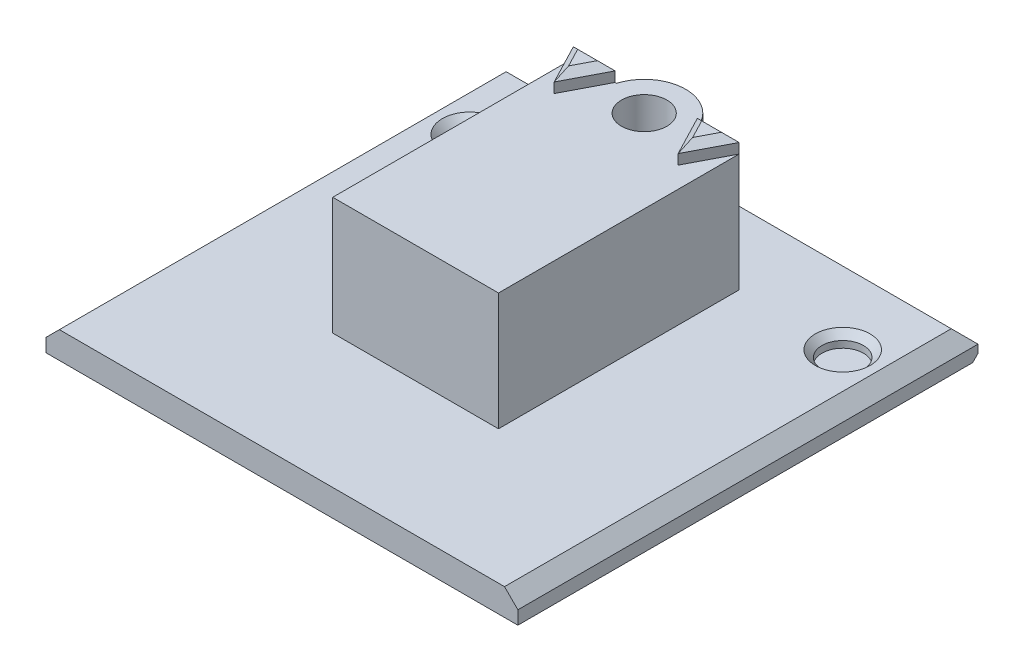
from build123d import *

# Parameters (mm, degrees)
SKETCH1_W           = 35.3
SKETCH1_H           = 34.42
BOSS_EXTRUDE1_DEPTH = 2
BOSS_EXTRUDE2_DEPTH = 8.8
SKETCH4_R           = 1.55
CUT_EXTRUDE2_DEPTH  = 1
CHAMFER4_SIZE       = 0.5
BOSS_EXTRUDE3_DEPTH = 1.25
SKETCH7_R           = 1.7
CUT_EXTRUDE6_DEPTH  = 51.472432079
SKETCH6_R           = 2.85
CUT_EXTRUDE5_DEPTH  = 3
CHAMFER5_SIZE       = 0.5
CHAMFER3_SIZE       = 1
CHAMFER6_SIZE       = 0.4


with BuildPart() as part:
    # Sketch1 → Boss-Extrude1 (new body)
    with BuildSketch(Plane(origin=(0, 0, 0), x_dir=(1, 0, 0), z_dir=(0, 1, 0))):
        with Locations((17.65, 17.21)):
            Rectangle(SKETCH1_W, SKETCH1_H)
    extrude(amount=BOSS_EXTRUDE1_DEPTH)

    # Sketch2 → Boss-Extrude2 (add)
    with BuildSketch(Plane(origin=(0, 2, 0), x_dir=(1, 0, 0), z_dir=(0, 1, 0))):
        with BuildLine():
            Line((11.45, 28), (14.683520605, 28))
            ThreePointArc((14.683520605, 28), (17.65, 30.2), (20.616479395, 28))
            Line((20.616479395, 28), (23.85, 28))
            Line((23.85, 28), (23.85, 10))
            Line((23.85, 10), (11.45, 10))
            Line((11.45, 10), (11.45, 28))
        make_face()
    extrude(amount=BOSS_EXTRUDE2_DEPTH)

    # Sketch4 → Cut-Extrude2 (cut)
    with BuildSketch(Plane(origin=(0, 2, 0), x_dir=(1, 0, 0), z_dir=(0, 1, 0))):
        with Locations(Location((3.7, 28, 0), (0, 0, 270))):
            Circle(SKETCH4_R)
        with Locations(Location((31.6, 28, 0), (0, 0, 90))):
            Circle(SKETCH4_R)
    extrude(amount=-CUT_EXTRUDE2_DEPTH, mode=Mode.SUBTRACT)

    # Chamfer4
    chamfer4_edges = [part.edges().sort_by_distance(p)[0] for p in [
        (3.7, 2, -29.55),
        (31.6, 2, -26.45),
    ]]
    chamfer(chamfer4_edges, length=CHAMFER4_SIZE)

    # Sketch3 → Boss-Extrude3 (add)
    with BuildSketch(Plane(origin=(0, 10.8, 0), x_dir=(1, 0, 0), z_dir=(0, 1, 0))):
        Polygon((14.573402303, 28), (13.011701152, 25), (11.45, 28), align=None)
        Polygon((23.85, 28), (22.288298848, 25), (20.726597697, 28), align=None)
    extrude(amount=BOSS_EXTRUDE3_DEPTH)

    # Sketch7 → Cut-Extrude6 (cut, through all)
    with BuildSketch(Plane(origin=(0, 10.8, 0), x_dir=(1, 0, 0), z_dir=(0, 1, 0))):
        with Locations(Location((17.65, 27.1, 0), (0, 0, 270))):
            Circle(SKETCH7_R)
    extrude(amount=-CUT_EXTRUDE6_DEPTH, mode=Mode.SUBTRACT)

    # Sketch6 → Cut-Extrude5 (cut)
    with BuildSketch(Plane.XZ):
        with Locations(Location((17.65, -27.1, 0), (0, 0, 270))):
            Circle(SKETCH6_R)
    extrude(amount=-CUT_EXTRUDE5_DEPTH, mode=Mode.SUBTRACT)

    # Chamfer5
    chamfer5_edges = [part.edges().sort_by_distance(p)[0] for p in [
        (22.288298848, 12.05, -28),
        (21.507448273, 12.05, -26.5),
        (23.069149424, 12.05, -26.5),
        (13.011701152, 12.05, -28),
        (12.230850576, 12.05, -26.5),
        (13.792551727, 12.05, -26.5),
    ]]
    chamfer(chamfer5_edges, length=CHAMFER5_SIZE)

    # Chamfer3
    chamfer3_edges = [part.edges().sort_by_distance(p)[0] for p in [
        (35.3, 2, -17.21),
        (17.65, 2, -34.42),
        (0, 2, -17.21),
    ]]
    chamfer(chamfer3_edges, length=CHAMFER3_SIZE)

    # Chamfer6
    chamfer6_edges = [part.edges().sort_by_distance(p)[0] for p in [
        (17.65, 0, -34.42),
    ]]
    chamfer(chamfer6_edges, length=CHAMFER6_SIZE)


solid = part.part
